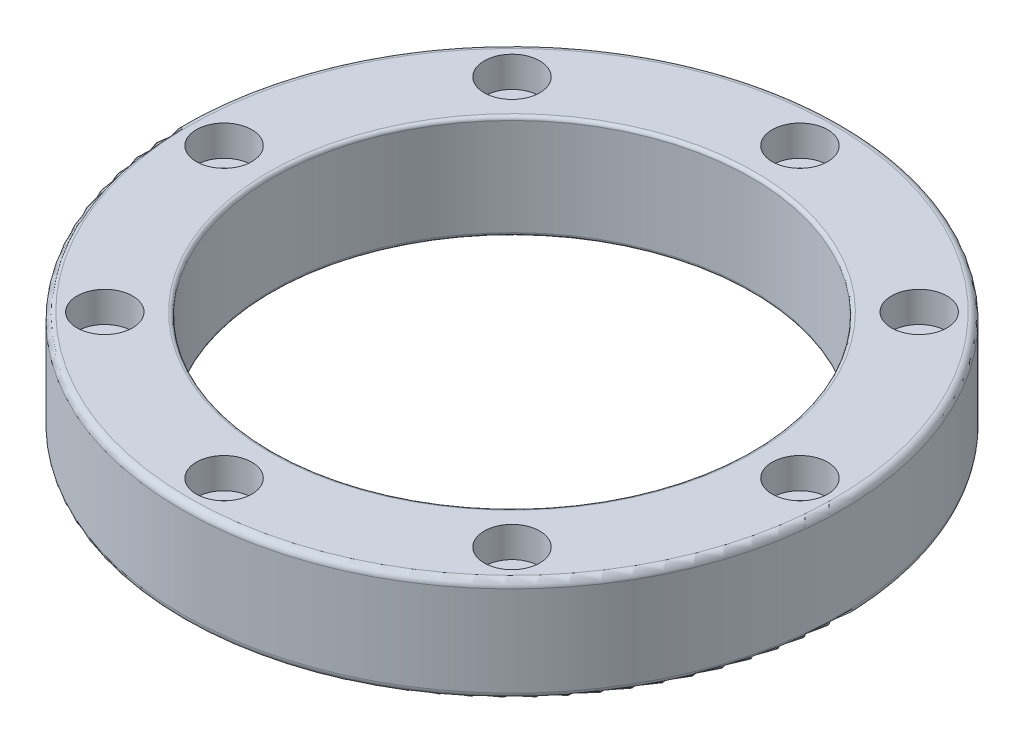
from build123d import *

# Parameters (mm, degrees)
SKETCH1_R           = 47.5
SKETCH1_R_2         = 34.5
BOSS_EXTRUDE1_DEPTH = 15
SKETCH2_R           = 2.25
CUT_EXTRUDE1_DEPTH  = 69.82949949
SKETCH3_R           = 4
CUT_EXTRUDE2_DEPTH  = 4.4
FILLET1_R           = 1
FILLET2_R           = 0.5


with BuildPart() as part:
    # Sketch1 → Boss-Extrude1 (new body)
    with BuildSketch(Plane(origin=(0, 0, 0), x_dir=(1, 0, 0), z_dir=(0, 1, 0))):
        with Locations(Location((0, 0, 0), (0, 0, 270))):
            Circle(SKETCH1_R)
        with Locations(Location((0, 0, 0), (0, 0, 270))):
            Circle(SKETCH1_R_2, mode=Mode.SUBTRACT)
    extrude(amount=BOSS_EXTRUDE1_DEPTH)

    # Sketch2 → Cut-Extrude1 (cut, through all)
    with BuildSketch(Plane(origin=(0, 15, 0), x_dir=(1, 0, 0), z_dir=(0, 1, 0))):
        with Locations(Location((0, 41.5, 0), (0, 0, 270))):
            Circle(SKETCH2_R)
        with Locations(Location((29.344931419, 29.344931419, 0), (0, 0, 270))):
            Circle(SKETCH2_R)
        with Locations(Location((41.5, 0, 0), (0, 0, 270))):
            Circle(SKETCH2_R)
        with Locations(Location((29.344931419, -29.344931419, 0), (0, 0, 270))):
            Circle(SKETCH2_R)
        with Locations(Location((0, -41.5, 0), (0, 0, 270))):
            Circle(SKETCH2_R)
        with Locations(Location((-29.344931419, -29.344931419, 0), (0, 0, 270))):
            Circle(SKETCH2_R)
        with Locations(Location((-41.5, 0, 0), (0, 0, 270))):
            Circle(SKETCH2_R)
        with Locations(Location((-29.344931419, 29.344931419, 0), (0, 0, 270))):
            Circle(SKETCH2_R)
    extrude(amount=-CUT_EXTRUDE1_DEPTH, mode=Mode.SUBTRACT)

    # Sketch3 → Cut-Extrude2 (cut)
    with BuildSketch(Plane(origin=(0, 15, 0), x_dir=(1, 0, 0), z_dir=(0, 1, 0))):
        with Locations(Location((0, 41.5, 0), (0, 0, 270))):
            Circle(SKETCH3_R)
        with Locations(Location((29.344931419, 29.344931419, 0), (0, 0, 270))):
            Circle(SKETCH3_R)
        with Locations(Location((41.5, 0, 0), (0, 0, 270))):
            Circle(SKETCH3_R)
        with Locations(Location((29.344931419, -29.344931419, 0), (0, 0, 270))):
            Circle(SKETCH3_R)
        with Locations(Location((0, -41.5, 0), (0, 0, 270))):
            Circle(SKETCH3_R)
        with Locations(Location((-29.344931419, -29.344931419, 0), (0, 0, 270))):
            Circle(SKETCH3_R)
        with Locations(Location((-41.5, 0, 0), (0, 0, 270))):
            Circle(SKETCH3_R)
        with Locations(Location((-29.344931419, 29.344931419, 0), (0, 0, 270))):
            Circle(SKETCH3_R)
    extrude(amount=-CUT_EXTRUDE2_DEPTH, mode=Mode.SUBTRACT)

    # Fillet1
    fillet1_edges = [part.edges().sort_by_distance(p)[0] for p in [
        (0, 0, -47.5),
        (0, 15, -47.5),
    ]]
    fillet(fillet1_edges, radius=FILLET1_R)

    # Fillet2
    fillet2_edges = [part.edges().sort_by_distance(p)[0] for p in [
        (0, 0, -34.5),
        (0, 15, -34.5),
    ]]
    fillet(fillet2_edges, radius=FILLET2_R)


solid = part.part
